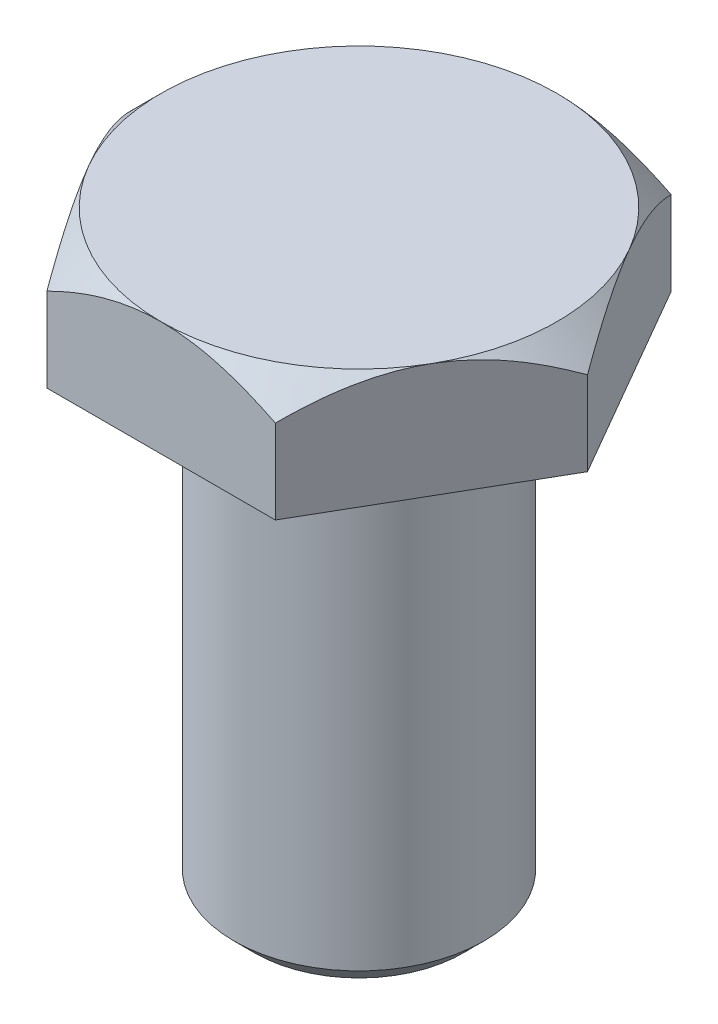
from build123d import *

# Parameters (mm, degrees)
SZKIC1_R                    = 6
DODANIE_WYCI_GNI_CIE1_DEPTH = 23
DODANIE_WYCI_GNI_CIE2_DEPTH = 5.5
SFAZOWANIE1_SIZE            = 1


with BuildPart() as part:
    # Szkic1 → Dodanie-wyciągnięcie1 (new body)
    with BuildSketch(Plane(origin=(0, 0, 0), x_dir=(1, 0, 0), z_dir=(0, 1, 0))):
        with Locations(Location((0, 0, 0), (0, 0, 270))):
            Circle(SZKIC1_R)
    extrude(amount=-DODANIE_WYCI_GNI_CIE1_DEPTH)

    # Szkic2 → Dodanie-wyciągnięcie2 (add)
    with BuildSketch(Plane(origin=(0, 0, 0), x_dir=(1, 0, 0), z_dir=(0, 1, 0))):
        Polygon((10.969655115, 0), (5.484827557, 9.5), (-5.484827557, 9.5), (-10.969655115, 0), (-5.484827557, -9.5), (5.484827557, -9.5), align=None)
    extrude(amount=DODANIE_WYCI_GNI_CIE2_DEPTH)

    # Szkic4 → Wycięcie-obrót1 (revolve, cut)
    with BuildSketch(Plane.XY):
        Polygon((10.969655115, 4.030344885), (9.5, 5.5), (10.969655115, 5.5), align=None)
    revolve(axis=Axis((0, 5.5, 0), (0, -1, 0)), mode=Mode.SUBTRACT)

    # Sfazowanie1
    sfazowanie1_edges = [part.edges().sort_by_distance(p)[0] for p in [
        (0, -23, -6),
    ]]
    chamfer(sfazowanie1_edges, length=SFAZOWANIE1_SIZE)


solid = part.part
